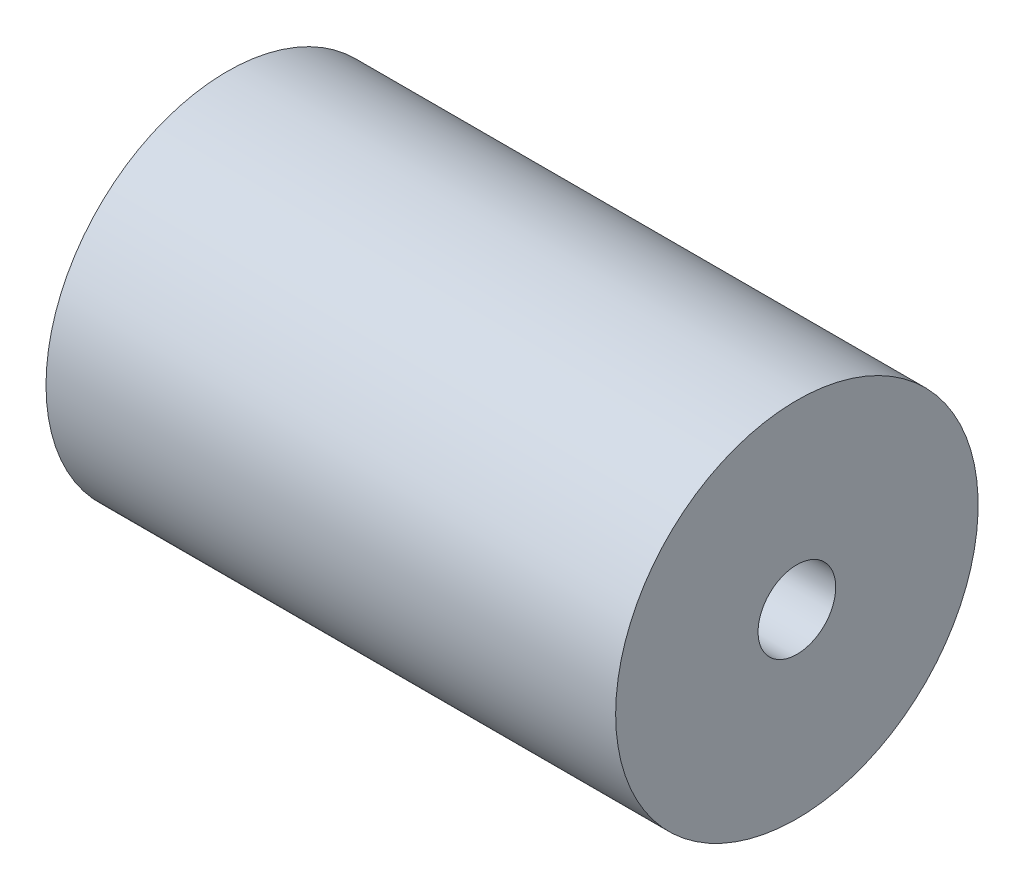
from build123d import *

# Parameters (mm, degrees)
SKETCH_1_W      = 22
SKETCH_1_H      = 4
SKETCH_3_R      = 3
SKETCH_3_R_2    = 1.5
EXTRUDE_1_DEPTH = 5


with BuildPart() as part:
    # 草图1 → 旋转1 (revolve)
    with BuildSketch(Plane.XY, mode=Mode.PRIVATE) as revolve_1_sk:
        with Locations((0, 5)):
            Rectangle(SKETCH_1_W, SKETCH_1_H)
    revolve(revolve_1_sk.sketch.rotate(Axis((0, 0, 0), (1, 0, 0)), 90), axis=Axis((0, 0, 0), (1, 0, 0)))

    # 草图3 → 凸台-拉伸1 (add)
    with BuildSketch(Plane(origin=(11, 0, 0), x_dir=(0, 0, -1), z_dir=(1, 0, 0))):
        with Locations(Location((0, 0, 0), (0, 0, 180))):
            Circle(SKETCH_3_R)
        Circle(SKETCH_3_R_2, mode=Mode.SUBTRACT)
    extrude(amount=-EXTRUDE_1_DEPTH)


solid = part.part
